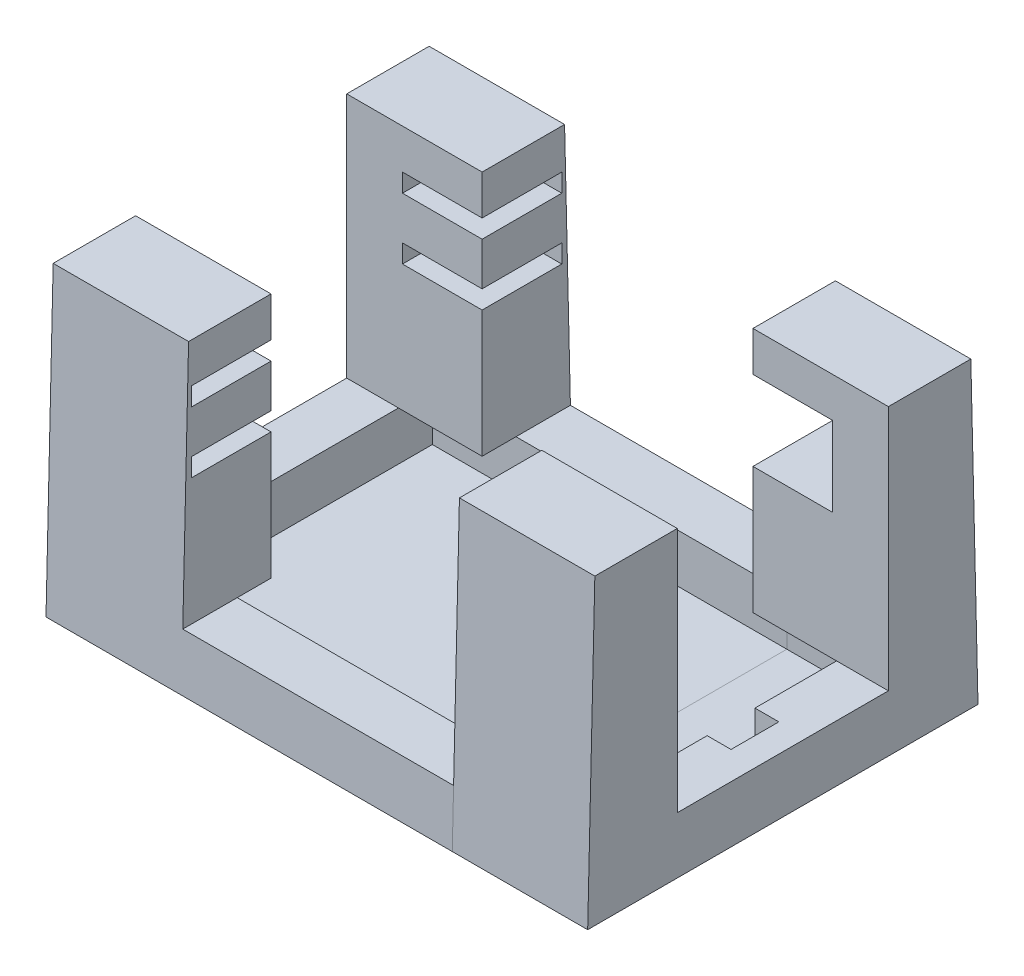
from build123d import *

# Parameters (mm, degrees)
SKETCH3_W           = 68
SKETCH3_H           = 49
BOSS_EXTRUDE1_DEPTH = 7.1
SKETCH6_W           = 17
SKETCH6_H           = 11.25
BOSS_EXTRUDE2_DEPTH = 38
CUT_EXTRUDE2_START  = -17
SKETCH7_W           = 46.5
SKETCH7_H           = 10
CUT_EXTRUDE2_DEPTH  = 10
CUT_EXTRUDE3_START  = -17
SKETCH9_W           = 46.5
SKETCH9_H           = 10
CUT_EXTRUDE3_DEPTH  = 10
SKETCH10_W          = 11.25
SKETCH10_H          = 5.4
BOSS_EXTRUDE3_DEPTH = 17
CUT_EXTRUDE4_START  = -1
SKETCH11_W          = 55
SKETCH11_H          = 35
CUT_EXTRUDE4_DEPTH  = 6.1
CUT_EXTRUDE5_REACH  = 58.571
SKETCH12_W          = 3
SKETCH12_H          = 6
CUT_EXTRUDE9_DEPTH  = 82.659353414


with BuildPart() as part:
    # Sketch3 → Boss-Extrude1 (new body)
    with BuildSketch(Plane(origin=(0, 0, 0), x_dir=(1, 0, 0), z_dir=(0, 1, 0))):
        Rectangle(SKETCH3_W, SKETCH3_H)
    extrude(amount=BOSS_EXTRUDE1_DEPTH)

    # Sketch6 → Boss-Extrude2 (add)
    with BuildSketch(Plane.XZ):
        with Locations((25.5, 18.875)):
            Rectangle(SKETCH6_W, SKETCH6_H)
        with Locations((-25.5, 18.875)):
            Rectangle(SKETCH6_W, SKETCH6_H)
        with Locations((-25.5, -18.875)):
            Rectangle(SKETCH6_W, SKETCH6_H)
        with Locations((25.5, -18.875)):
            Rectangle(SKETCH6_W, SKETCH6_H)
    extrude(amount=-BOSS_EXTRUDE2_DEPTH)

    # Sketch7 → Cut-Extrude2 (cut)
    with BuildSketch(Plane(origin=(34, 0, 0), x_dir=(0, 0, -1), z_dir=(1, 0, 0)).offset(CUT_EXTRUDE2_START)):
        with Locations((0, 28)):
            Rectangle(SKETCH7_W, SKETCH7_H)
    extrude(amount=CUT_EXTRUDE2_DEPTH, mode=Mode.SUBTRACT)

    # Sketch9 → Cut-Extrude3 (cut)
    with BuildSketch(Plane.ZY.offset(34).offset(CUT_EXTRUDE3_START)):
        with Locations((0, 28)):
            Rectangle(SKETCH9_W, SKETCH9_H)
    extrude(amount=CUT_EXTRUDE3_DEPTH, mode=Mode.SUBTRACT)

    # Sketch10 → Boss-Extrude3 (add)
    with BuildSketch(Plane.ZY.offset(34)):
        with Locations((18.875, 28)):
            Rectangle(SKETCH10_W, SKETCH10_H)
        with Locations((-18.875, 28)):
            Rectangle(SKETCH10_W, SKETCH10_H)
    extrude(amount=-BOSS_EXTRUDE3_DEPTH)

    # Sketch11 → Cut-Extrude4 (cut)
    with BuildSketch(Plane.XZ.offset(CUT_EXTRUDE4_START)):
        Rectangle(SKETCH11_W, SKETCH11_H)
    extrude(amount=-CUT_EXTRUDE4_DEPTH, mode=Mode.SUBTRACT)

    # Sketch12 → Cut-Extrude5 (cut, up to next)
    with BuildSketch(Plane.XZ, mode=Mode.PRIVATE) as cut_extrude5_sk1:
        with Locations((29, 0)):
            Rectangle(SKETCH12_W, SKETCH12_H)
    cut_extrude5_tool1 = extrude(cut_extrude5_sk1.sketch, amount=-CUT_EXTRUDE5_REACH, mode=Mode.PRIVATE) & part.part
    add(cut_extrude5_tool1.solids().sort_by_distance((29, 0, 0))[0], mode=Mode.SUBTRACT)

    # Sketch13 → Cut-Extrude9 (cut, through all)
    with BuildSketch(Plane(origin=(34, 0, 0), x_dir=(0, 0, -1), z_dir=(1, 0, 0))):
        Polygon((-24.5, 0), (-23.6, 38), (-24.5, 38), align=None)
        Polygon((24.5, 0), (23.6, 38), (24.5, 38), align=None)
    extrude(amount=-CUT_EXTRUDE9_DEPTH, mode=Mode.SUBTRACT)


with BuildPart() as body_2:
    # Split1: the piece on the far side of the plane
    add(part.part)
    split(bisect_by=Plane(origin=(17, 0, 0), x_dir=(0, 0, 1), z_dir=(1, 0, 0)), keep=Keep.BOTTOM)


with BuildPart() as part_1:
    add(part.part)

    # Split1
    split(bisect_by=Plane(origin=(17, 0, 0), x_dir=(0, 0, 1), z_dir=(1, 0, 0)), keep=Keep.TOP)


solid = Compound([body_2.part, part_1.part])
